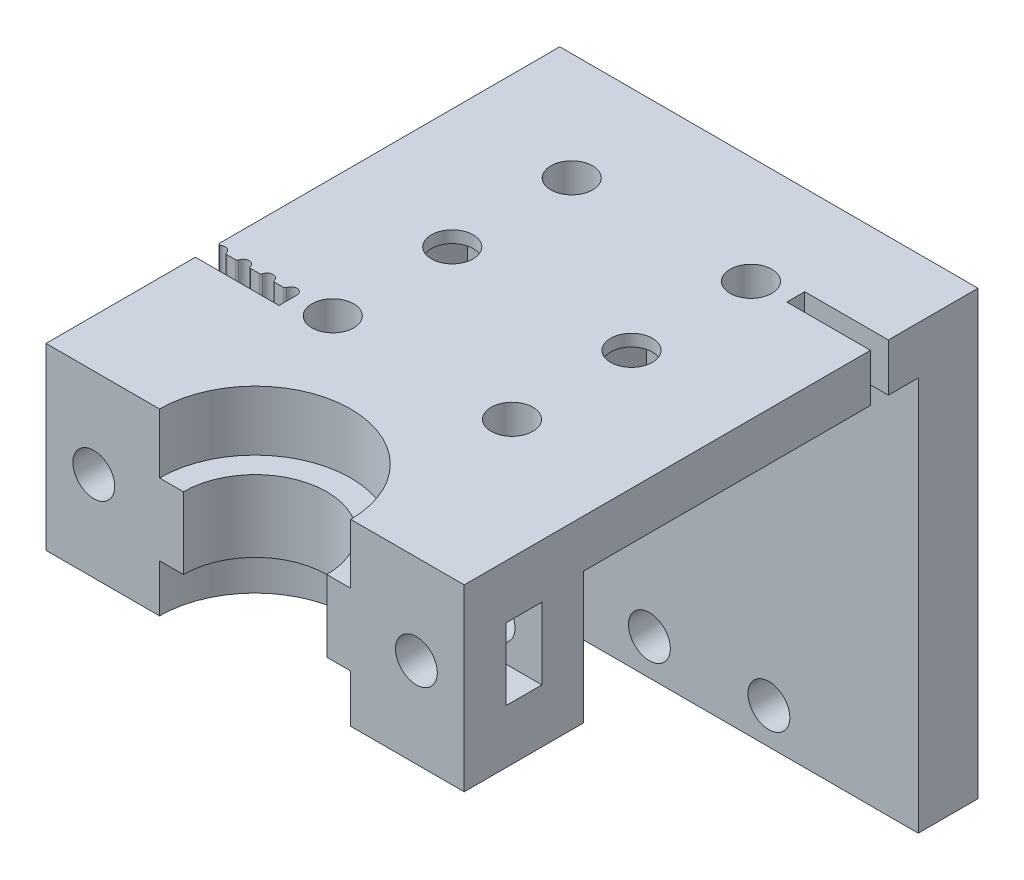
from build123d import *

# Parameters (mm, degrees)
SKETCH1_W           = 35
SKETCH1_H           = 28
BOSS_EXTRUDE1_DEPTH = 4
SKETCH2_R           = 1.75
CUT_EXTRUDE1_DEPTH  = 23.765104876
SKETCH3_W           = 35
SKETCH3_H           = 15
BOSS_EXTRUDE2_DEPTH = 10
CUT_REVOLVE1_ANGLE  = 180
SKETCH6_R           = 1.75
CUT_EXTRUDE3_DEPTH  = 10
SKETCH8_W           = 3
SKETCH8_H           = 6
CUT_EXTRUDE4_DEPTH  = 7
SKETCH9_W           = 3
SKETCH9_H           = 6
CUT_EXTRUDE5_DEPTH  = 7
SKETCH7_W           = 35
SKETCH7_H           = 37
BOSS_EXTRUDE3_DEPTH = 5
SKETCH10_R          = 1.75
CUT_EXTRUDE6_DEPTH  = 5
SKETCH18_W          = 7
SKETCH18_H          = 1.5
CUT_EXTRUDE14_DEPTH = 48.44733923
SKETCH19_R          = 1.75
CUT_EXTRUDE15_DEPTH = 48.44733923
CUT_EXTRUDE16_DEPTH = 3
SKETCH21_R          = 0.5
CUT_EXTRUDE17_DEPTH = 4
LPATTERN2_COUNT     = 4
LPATTERN2_PITCH     = 2
FILLET2_R           = 0.15


with BuildPart() as part:
    # Sketch1 → Boss-Extrude1 (new body)
    with BuildSketch(Plane(origin=(0, 0, 0), x_dir=(1, 0, 0), z_dir=(0, 1, 0))):
        Rectangle(SKETCH1_W, SKETCH1_H)
    extrude(amount=BOSS_EXTRUDE1_DEPTH)

    # Sketch2 → Cut-Extrude1 (cut, through all)
    with BuildSketch(Plane(origin=(0, 4, 0), x_dir=(1, 0, 0), z_dir=(0, 1, 0))):
        with Locations(Location((-7.5, -10, 0), (0, 0, 270))):
            Circle(SKETCH2_R)
        with Locations(Location((-7.5, 10, 0), (0, 0, 270))):
            Circle(SKETCH2_R)
        with Locations(Location((7.5, -10, 0), (0, 0, 270))):
            Circle(SKETCH2_R)
        with Locations(Location((7.5, 10, 0), (0, 0, 270))):
            Circle(SKETCH2_R)
    extrude(amount=-CUT_EXTRUDE1_DEPTH, mode=Mode.SUBTRACT)

    # Sketch3 → Boss-Extrude2 (add)
    with BuildSketch(Plane.XY.offset(14)):
        with Locations((0, -3.5)):
            Rectangle(SKETCH3_W, SKETCH3_H)
    extrude(amount=BOSS_EXTRUDE2_DEPTH)

    # Sketch5 → Cut-Revolve1 (revolve, cut)
    with BuildSketch(Plane.XY.offset(24)):
        Polygon((0, 4), (8, 4), (8, -1), (6, -1), (6, -7), (8, -7), (8, -11), (0, -11), align=None)
    revolve(axis=Axis((0, 4, 24), (0, 1, 0)), revolution_arc=CUT_REVOLVE1_ANGLE, mode=Mode.SUBTRACT)

    # Sketch6 → Cut-Extrude3 (cut)
    with BuildSketch(Plane.XY.offset(24)):
        with Locations((-13.5, -3.5)):
            Circle(SKETCH6_R)
        with Locations((13.5, -3.5)):
            Circle(SKETCH6_R)
    extrude(amount=-CUT_EXTRUDE3_DEPTH, mode=Mode.SUBTRACT)

    # Sketch8 → Cut-Extrude4 (cut)
    with BuildSketch(Plane.ZY.offset(17.5)):
        with Locations((19, -3.5)):
            Rectangle(SKETCH8_W, SKETCH8_H)
    extrude(amount=-CUT_EXTRUDE4_DEPTH, mode=Mode.SUBTRACT)

    # Sketch9 → Cut-Extrude5 (cut)
    with BuildSketch(Plane(origin=(17.5, 0, 0), x_dir=(0, 0, -1), z_dir=(1, 0, 0))):
        with Locations((-19, -3.5)):
            Rectangle(SKETCH9_W, SKETCH9_H)
    extrude(amount=-CUT_EXTRUDE5_DEPTH, mode=Mode.SUBTRACT)

    # Sketch7 → Boss-Extrude3 (add)
    with BuildSketch(Plane(origin=(0, 0, -14), x_dir=(-1, 0, 0), z_dir=(0, 0, -1))):
        with Locations((0, -14.5)):
            Rectangle(SKETCH7_W, SKETCH7_H)
    extrude(amount=BOSS_EXTRUDE3_DEPTH)

    # Sketch10 → Cut-Extrude6 (cut)
    with BuildSketch(Plane(origin=(0, 0, -19), x_dir=(-1, 0, 0), z_dir=(0, 0, -1))):
        with Locations((-5, -30)):
            Circle(SKETCH10_R)
        with Locations((5, -30)):
            Circle(SKETCH10_R)
    extrude(amount=-CUT_EXTRUDE6_DEPTH, mode=Mode.SUBTRACT)

    # Sketch18 → Cut-Extrude14 (cut, through all)
    with BuildSketch(Plane(origin=(0, 4, 0), x_dir=(1, 0, 0), z_dir=(0, 1, 0))):
        with Locations((-14, -10.75)):
            Rectangle(SKETCH18_W, SKETCH18_H)
        with Locations((14, 10.75)):
            Rectangle(SKETCH18_W, SKETCH18_H)
    extrude(amount=-CUT_EXTRUDE14_DEPTH, mode=Mode.SUBTRACT)

    # Sketch19 → Cut-Extrude15 (cut, through all)
    with BuildSketch(Plane(origin=(0, 4, 0), x_dir=(1, 0, 0), z_dir=(0, 1, 0))):
        with Locations(Location((-7.5, 0, 0), (0, 0, 270))):
            Circle(SKETCH19_R)
        with Locations(Location((7.5, 0, 0), (0, 0, 270))):
            Circle(SKETCH19_R)
    extrude(amount=-CUT_EXTRUDE15_DEPTH, mode=Mode.SUBTRACT)

    # Sketch20 → Cut-Extrude16 (cut)
    with BuildSketch(Plane.XZ):
        Polygon((10.964101615, 0), (9.232050808, 3), (5.767949192, 3), (4.035898385, 0), (5.767949192, -3), (9.232050808, -3), align=None)
        Polygon((-10.964101615, 0), (-9.232050808, -3), (-5.767949192, -3), (-4.035898385, 0), (-5.767949192, 3), (-9.232050808, 3), align=None)
    extrude(amount=-CUT_EXTRUDE16_DEPTH, mode=Mode.SUBTRACT)

    # Sketch21 → Cut-Extrude17 (cut)
    with BuildSketch(Plane(origin=(0, 4, 0), x_dir=(1, 0, 0), z_dir=(0, 1, 0))):
        with Locations((-17, -10)):
            Circle(SKETCH21_R)
    cut_extrude17 = extrude(amount=-CUT_EXTRUDE17_DEPTH, mode=Mode.SUBTRACT)

    # LPattern2: Cut-Extrude17 ×4
    with Locations(*[(i * LPATTERN2_PITCH, 0, 0) for i in range(1, LPATTERN2_COUNT)]):
        add(cut_extrude17, mode=Mode.SUBTRACT)

    # Fillet2
    fillet2_edges = [part.edges().sort_by_distance(p)[0] for p in [
        (-17.5, 2, 10),
        (-16.5, 2, 10),
        (-12.5, 2, 10),
        (-13.5, 2, 10),
        (-14.5, 2, 10),
        (-15.5, 2, 10),
        (-11.5, 2, 10),
    ]]
    fillet(fillet2_edges, radius=FILLET2_R)


solid = part.part
